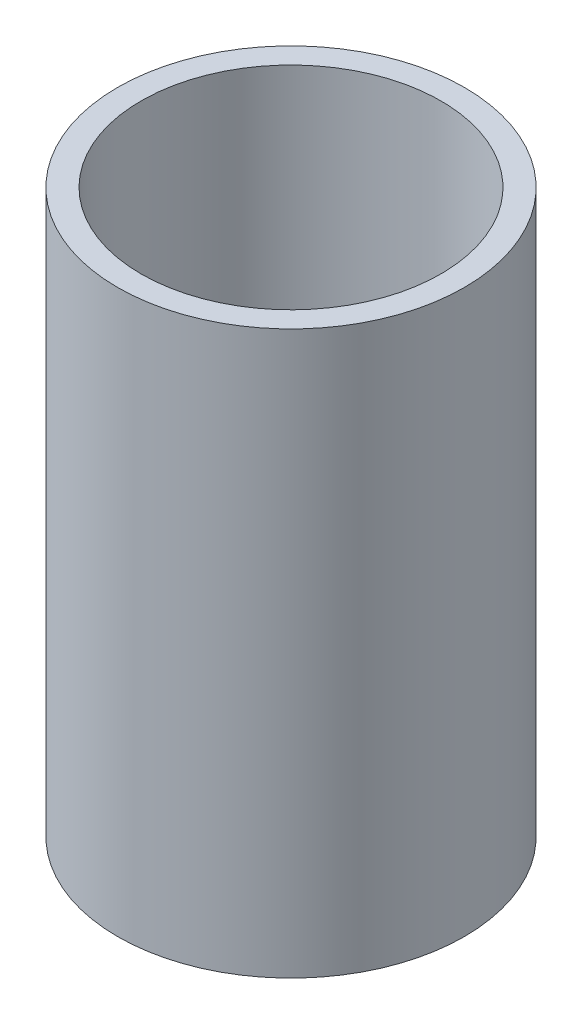
from build123d import *

# Parameters (mm, degrees)
SKETCH1_R               = 9.25
BOSS_EXTRUDE1_DEPTH     = 30
CUT_EXTRUDE1_START      = 30
SKETCH1_3_R             = 8
CUT_EXTRUDE1_DEPTH      = 28
CUT_EXTRUDE3_DEPTH      = 33.728046077
CUT_EXTRUDE3_DEPTH_BACK = 33.728046077
SKETCH1_4_R             = 2


with BuildPart() as part:
    # Sketch1 → Boss-Extrude1 (new body)
    with BuildSketch(Plane(origin=(0, 0, 0), x_dir=(1, 0, 0), z_dir=(0, 1, 0))):
        with Locations(Location((0, 0, 0), (0, 0, 270))):
            Circle(SKETCH1_R)
    extrude(amount=BOSS_EXTRUDE1_DEPTH)

    # Sketch1<3> → Cut-Extrude1 (cut)
    with BuildSketch(Plane(origin=(0, 0, 0), x_dir=(1, 0, 0), z_dir=(0, 1, 0)).offset(CUT_EXTRUDE1_START)):
        with Locations(Location((0, 0, 0), (0, 0, 270))):
            Circle(SKETCH1_3_R)
    extrude(amount=-CUT_EXTRUDE1_DEPTH, mode=Mode.SUBTRACT)

    # Sketch1<4> → Cut-Extrude3 (cut, two sides: drawn at the far end of the back side and taken through both)
    with BuildSketch(Plane(origin=(0, 0, 0), x_dir=(1, 0, 0), z_dir=(0, 1, 0)).offset(-CUT_EXTRUDE3_DEPTH_BACK)):
        with Locations(Location((0, 0, 0), (0, 0, 270))):
            Circle(SKETCH1_4_R)
    extrude(amount=CUT_EXTRUDE3_DEPTH + CUT_EXTRUDE3_DEPTH_BACK, mode=Mode.SUBTRACT)


solid = part.part
